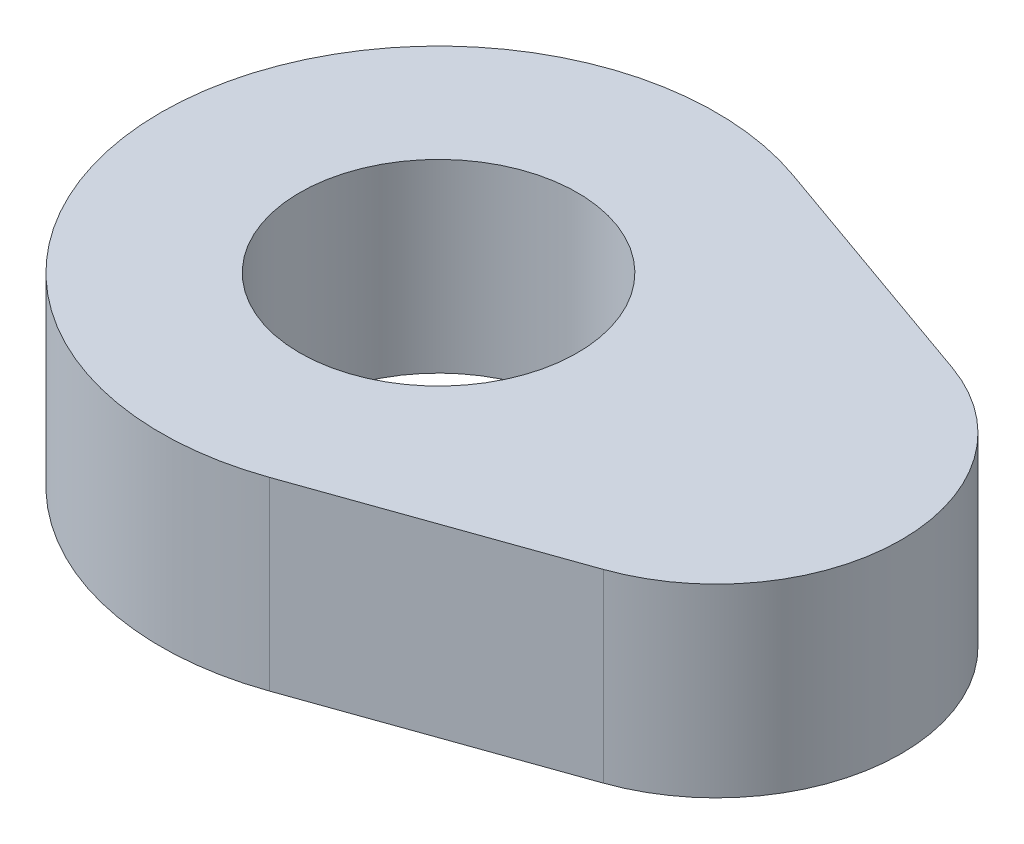
from build123d import *

# Parameters (mm, degrees)
EXTRUDE_1_DEPTH     = 10
SKETCH_2_R          = 7.5
CUT_EXTRUDE_1_DEPTH = 10


with BuildPart() as part:
    # 草图1 → 凸台-拉伸1 (new body)
    with BuildSketch(Plane(origin=(0, 0, 0), x_dir=(1, 0, 0), z_dir=(0, 1, 0))):
        with BuildLine():
            Line((-0.759854477, 9.958566069), (12.573478857, 5.244520861))
            ThreePointArc((12.573478857, 5.244520861), (19.240145523, -4.183569555), (12.573478857, -13.611659971))
            Line((12.573478857, -13.611659971), (-0.759854477, -18.325705179))
            ThreePointArc((-0.759854477, -18.325705179), (-20.759854477, -4.183569555), (-0.759854477, 9.958566069))
        make_face()
    extrude(amount=EXTRUDE_1_DEPTH)

    # 草图2 → 切除-拉伸1 (cut)
    with BuildSketch(Plane(origin=(0, 10, 0), x_dir=(1, 0, 0), z_dir=(0, 1, 0))):
        with Locations(Location((-5.759854477, -4.183569555, 0), (0, 0, 270))):
            Circle(SKETCH_2_R)
    extrude(amount=-CUT_EXTRUDE_1_DEPTH, mode=Mode.SUBTRACT)


solid = part.part
